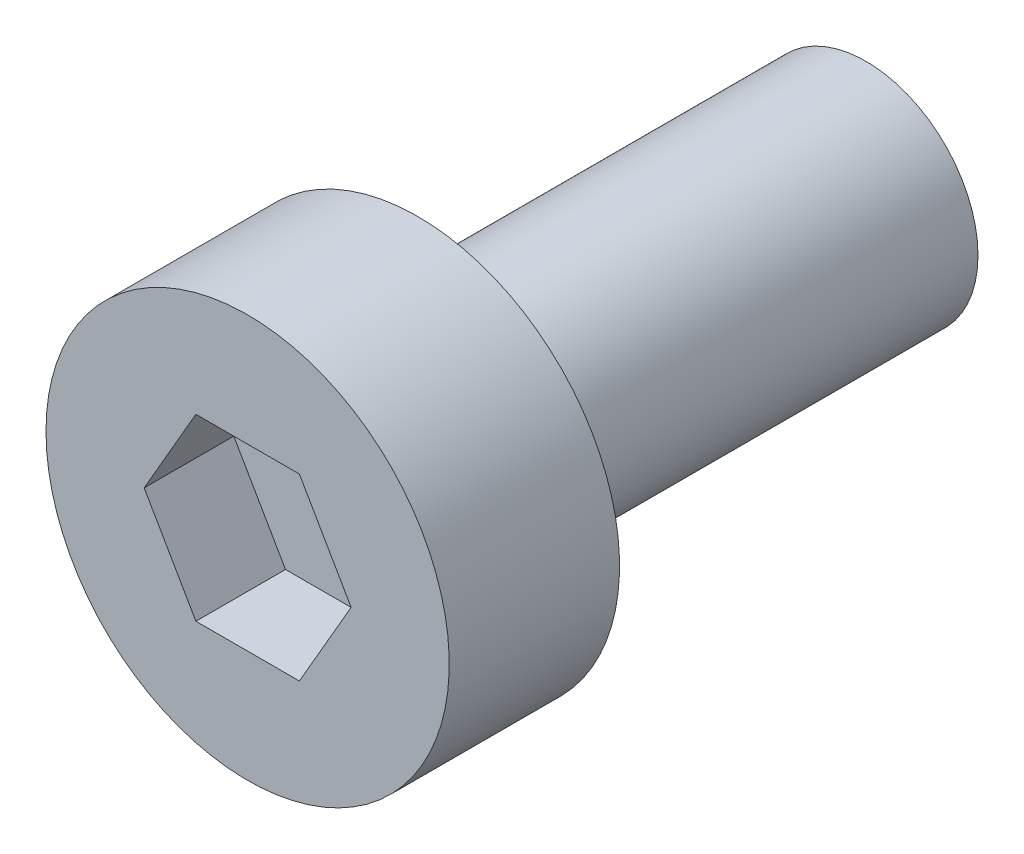
from build123d import *

# Parameters (mm, degrees)
ESQUISSE1_R             = 1.25
BOSS_EXTRU_1_DEPTH      = 5
ESQUISSE2_R             = 2.25
BOSS_EXTRU_2_DEPTH      = 1.9
ENL_V_MAT_EXTRU_1_DEPTH = 1


with BuildPart() as part:
    # Esquisse1 → Boss.-Extru.1 (new body)
    with BuildSketch(Plane.XY):
        Circle(ESQUISSE1_R)
    extrude(amount=BOSS_EXTRU_1_DEPTH)

    # Esquisse2 → Boss.-Extru.2 (add)
    with BuildSketch(Plane.XY.offset(5)):
        with Locations(Location((0, 0, 0), (0, 0, 180))):
            Circle(ESQUISSE2_R)
    extrude(amount=BOSS_EXTRU_2_DEPTH)

    # Esquisse3 → Enlèv. mat.-Extru.1 (cut)
    with BuildSketch(Plane.XY.offset(6.9)):
        Polygon((1.154700538, 0), (0.577350269, 1), (-0.577350269, 1), (-1.154700538, 0), (-0.577350269, -1), (0.577350269, -1), align=None)
    extrude(amount=-ENL_V_MAT_EXTRU_1_DEPTH, mode=Mode.SUBTRACT)


solid = part.part
